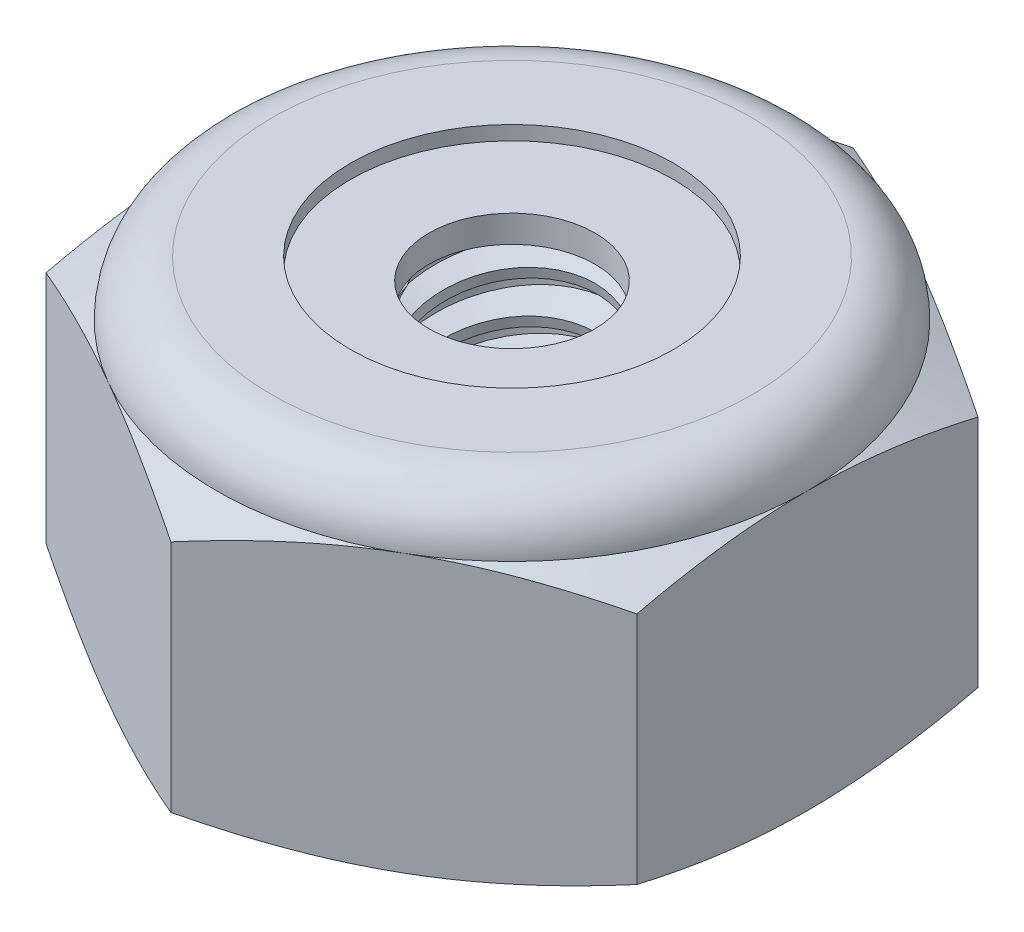
from build123d import *

# Parameters (mm, degrees)
EXTRUDE1_DEPTH       = 3.571875
SKETCH2_W            = 1.0922
SKETCH2_H            = 3.571875
LPATTERN1_COUNT      = 8
LPATTERN1_PITCH      = 0.453571429
LPATTERN1_COUNT_DIR2 = 2
LPATTERN1_PITCH_DIR2 = 0.453571429


with BuildPart() as part:
    # Sketch1 → Extrude1 (new body)
    with BuildSketch(Plane(origin=(0, 0, 0), x_dir=(1, 0, 0), z_dir=(0, 1, 0))):
        Polygon((0, 3.666174209), (-3.175, 1.833087105), (-3.175, -1.833087105), (0, -3.666174209), (3.175, -1.833087105), (3.175, 1.833087105), align=None)
    extrude(amount=EXTRUDE1_DEPTH)

    # Sketch4 → Cut-Revolve2 (revolve, cut)
    with BuildSketch(Plane(origin=(0, 0, 0), x_dir=(0, 0, -1), z_dir=(1, 0, 0))):
        Polygon((0, 3.571875), (1.0922, 3.571875), (0.892167741, 3.478598426), (0.892167741, 0.093276574), (1.0922, 0), (0, 0), align=None)
    revolve(axis=Axis((0, 3.571875, 0), (0, 1, 0)), mode=Mode.SUBTRACT)


with BuildPart() as body_2:
    # Sketch2 → Revolve1 (revolve)
    with BuildSketch(Plane(origin=(0, 0, 0), x_dir=(0, 0, -1), z_dir=(1, 0, 0))):
        with Locations((0.5461, 1.7859375)):
            Rectangle(SKETCH2_W, SKETCH2_H)
    revolve(axis=Axis((0, -1.0922, 0), (0, 1, 0)))

    # Sketch3 → Cut-Revolve1 (revolve, cut)
    with BuildSketch(Plane(origin=(0, 0, 0), x_dir=(0, 0, -1), z_dir=(1, 0, 0))):
        Polygon((1.103726651, 3.516362647), (1.184413211, 3.127776177), (0.915221043, 3.216645195), (0.892167741, 3.327669901), align=None)
    cut_revolve1 = revolve(axis=Axis((0, 3.571875, 0.101196353), (0, -0.9791155152480937, -0.20330471662128244)), mode=Mode.SUBTRACT)

    # LPattern1: Cut-Revolve1 8 × 2
    with Locations(*[Vector(0, -1, 0) * (i * LPATTERN1_PITCH) + Vector(0, 1, 0) * (j * LPATTERN1_PITCH_DIR2) for i in range(LPATTERN1_COUNT) for j in range(LPATTERN1_COUNT_DIR2) if (i, j) != (0, 0)]):
        add(cut_revolve1, mode=Mode.SUBTRACT)


with BuildPart() as part_1:
    add(part.part)

    # Combine1: cut body 2
    add(body_2.part, mode=Mode.SUBTRACT)

    # Sketch5 → Cut-Revolve3 (revolve, cut)
    with BuildSketch(Plane(origin=(0, 0, 0), x_dir=(0, 0, -1), z_dir=(1, 0, 0))):
        with BuildLine():
            Line((0, 0), (3.175, 0))
            Line((3.175, 0), (3.666174209, 0.229038295))
            Line((3.666174209, 0.229038295), (3.666174209, 2.747524205))
            Line((3.666174209, 2.747524205), (3.175, 2.9765625))
            ThreePointArc((3.175, 2.9765625), (3.000637006, 3.397512006), (2.5796875, 3.571875))
            Line((2.5796875, 3.571875), (2.5796875, 4.841875))
            Line((2.5796875, 4.841875), (4.936174209, 4.841875))
            Line((4.936174209, 4.841875), (4.936174209, -1.27))
            Line((4.936174209, -1.27), (0, -1.27))
            Line((0, -1.27), (0, 0))
        make_face()
    revolve(axis=Axis((0, 0, 0), (0, 1, 0)), mode=Mode.SUBTRACT)

    # Sketch6 → Cut-Revolve4 (revolve, cut)
    with BuildSketch(Plane(origin=(0, 0, 0), x_dir=(0, 0, -1), z_dir=(1, 0, 0))):
        with BuildLine():
            Line((0, 2.9765625), (3.0226, 2.9765625))
            ThreePointArc((3.0226, 2.9765625), (2.892873932, 3.289748932), (2.5796875, 3.419475))
            Line((2.5796875, 3.419475), (1.73592762, 3.419475))
            Line((1.73592762, 3.419475), (1.73592762, 4.841875))
            Line((1.73592762, 4.841875), (0, 4.841875))
            Line((0, 4.841875), (0, 2.9765625))
        make_face()
    revolve(axis=Axis((0, 4.841875, 0), (0, 1, 0)), mode=Mode.SUBTRACT)


with BuildPart() as body_2_2:
    # Sketch7 → Revolve2 (revolve)
    with BuildSketch(Plane(origin=(0, 0, 0), x_dir=(0, 0, -1), z_dir=(1, 0, 0))):
        with BuildLine():
            Line((0.892167741, 3.0527625), (2.938395763, 3.0527625))
            ThreePointArc((2.938395763, 3.0527625), (2.810484559, 3.261537543), (2.5796875, 3.343275))
            Line((2.5796875, 3.343275), (0.892167741, 3.343275))
            Line((0.892167741, 3.343275), (0.892167741, 3.0527625))
        make_face()
    revolve(axis=Axis((0, 3.0527625, 0), (0, 1, 0)))


solid = Compound([part_1.part, body_2_2.part])
